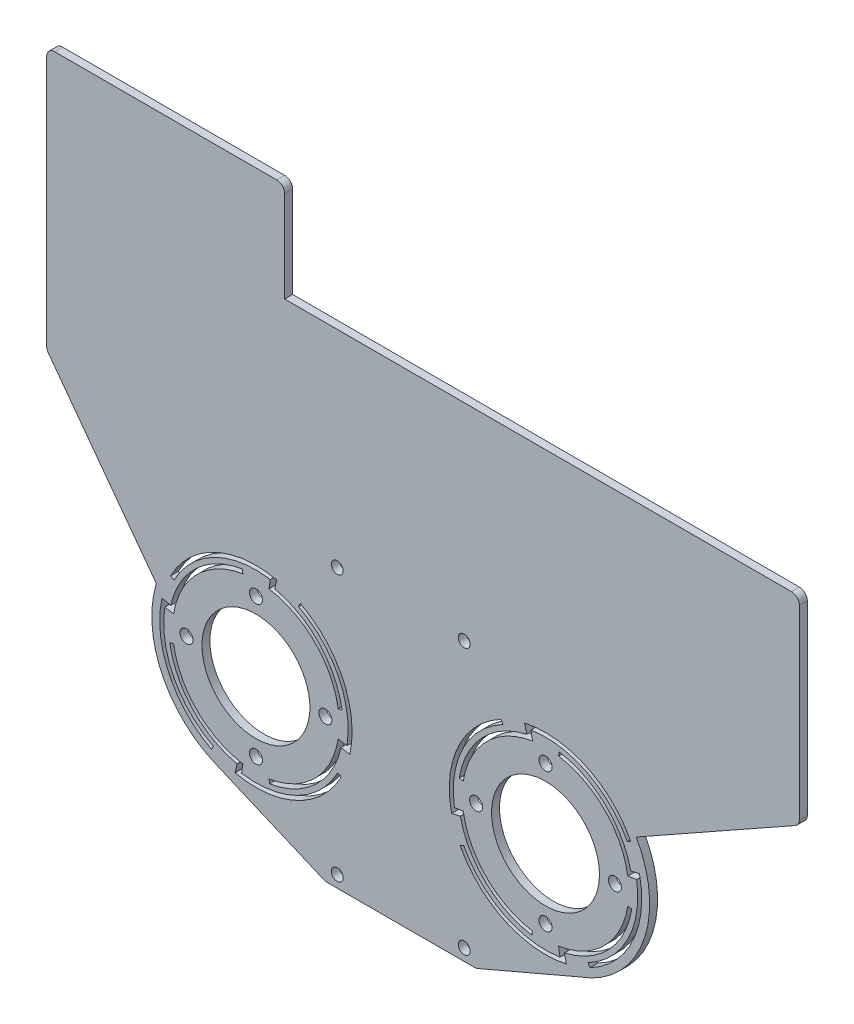
from build123d import *

# Parameters (mm, degrees)
SKETCH_1_R          = 21
SKETCH_1_R_2        = 13.6
SKETCH_1_R_3        = 1.65
EXTRUDE_1_DEPTH     = 2
EXTRUDE_1_2_DEPTH   = 2
SKETCH_2_R          = 26.25
EXTRUDE_3_DEPTH     = 2
EXTRUDE_4_DEPTH     = 2
FILLET_1_R          = 2
SKETCH_4_R          = 1.5
CUT_EXTRUDE_1_DEPTH = 2


with BuildPart() as part:
    # 草图1 → 凸台-拉伸1 (new body)
    with BuildSketch(Plane.XY):
        with Locations((36.5, 0)):
            Circle(SKETCH_1_R)
        with Locations((36.5, 0)):
            Circle(SKETCH_1_R_2, mode=Mode.SUBTRACT)
        with Locations((19, 0)):
            Circle(SKETCH_1_R_3, mode=Mode.SUBTRACT)
        with Locations((36.5, 17.5)):
            Circle(SKETCH_1_R_3, mode=Mode.SUBTRACT)
        with Locations((54, 0)):
            Circle(SKETCH_1_R_3, mode=Mode.SUBTRACT)
        with Locations((36.5, -17.5)):
            Circle(SKETCH_1_R_3, mode=Mode.SUBTRACT)
    extrude(amount=EXTRUDE_1_DEPTH)

    # 草图2 → 凸台-拉伸3 (add)
    # profile 1 of 4: a face of its own
    with BuildSketch(Plane.XY):
        with Locations((36.5, 0)):
            Circle(SKETCH_2_R)
        with BuildLine():
            Line((58.229143493, 3.441558231), (57.241455152, 3.285123766))
            ThreePointArc((57.241455152, 3.285123766), (57.435264008, 1.64764101), (57.5, 0))
            ThreePointArc((57.5, 0), (57.435264008, -1.64764101), (57.241455152, -3.285123766))
            Line((57.241455152, -3.285123766), (58.229143493, -3.441558231))
            ThreePointArc((58.229143493, -3.441558231), (52.524161337, -15.074025787), (41.261671507, -21.478512157))
            Line((41.261671507, -21.478512157), (41.748660638, -23.675178173))
            ThreePointArc((41.748660638, -23.675178173), (26.251507153, -21.977963836), (14.989987295, -11.197403871))
            Line((14.989987295, -11.197403871), (15.876998129, -10.735655258))
            ThreePointArc((15.876998129, -10.735655258), (26.035211246, -20.761760434), (40.137101312, -22.963753919))
            Line((40.137101312, -22.963753919), (39.785123766, -20.741455152))
            ThreePointArc((39.785123766, -20.741455152), (36.5, -21), (33.214876234, -20.741455152))
            Line((33.214876234, -20.741455152), (33.058441769, -21.729143493))
            ThreePointArc((33.058441769, -21.729143493), (21.425974213, -16.024161337), (15.021487843, -4.761671507))
            Line((15.021487843, -4.761671507), (12.824821827, -5.248660638))
            ThreePointArc((12.824821827, -5.248660638), (14.522036164, 10.248492847), (25.302596129, 21.510012705))
            Line((25.302596129, 21.510012705), (25.764344742, 20.623001871))
            ThreePointArc((25.764344742, 20.623001871), (15.738239566, 10.464788754), (13.536246081, -3.637101312))
            Line((13.536246081, -3.637101312), (14.770856507, -3.441558231))
            Line((14.770856507, -3.441558231), (15.758544848, -3.285123766))
            ThreePointArc((15.758544848, -3.285123766), (15.5, 0), (15.758544848, 3.285123766))
            Line((15.758544848, 3.285123766), (14.770856507, 3.441558231))
            ThreePointArc((14.770856507, 3.441558231), (20.475838663, 15.074025787), (31.738328493, 21.478512157))
            Line((31.738328493, 21.478512157), (31.251339362, 23.675178173))
            ThreePointArc((31.251339362, 23.675178173), (46.748492847, 21.977963836), (58.010012705, 11.197403871))
            ThreePointArc((58.010012705, 11.197403871), (59.287546054, 8.293988476), (60.175178173, 5.248660638))
            ThreePointArc((60.175178173, 5.248660638), (58.477963836, -10.248492847), (47.697403871, -21.510012705))
            Line((47.697403871, -21.510012705), (47.235655258, -20.623001871))
            ThreePointArc((47.235655258, -20.623001871), (57.261760434, -10.464788754), (59.463753919, 3.637101312))
            Line((59.463753919, 3.637101312), (58.229143493, 3.441558231))
        make_face(mode=Mode.SUBTRACT)
    # profile 2 of 4: a face of its own
    with BuildSketch(Plane.XY):
        with BuildLine():
            Line((39.785123766, 20.741455152), (39.941558231, 21.729143493))
            ThreePointArc((39.941558231, 21.729143493), (51.574025787, 16.024161337), (57.978512157, 4.761671507))
            Line((57.978512157, 4.761671507), (60.175178173, 5.248660638))
            ThreePointArc((60.175178173, 5.248660638), (59.287546054, 8.293988476), (58.010012705, 11.197403871))
            Line((58.010012705, 11.197403871), (57.123001871, 10.735655258))
            ThreePointArc((57.123001871, 10.735655258), (46.964788754, 20.761760434), (32.862898688, 22.963753919))
            Line((32.862898688, 22.963753919), (33.214876234, 20.741455152))
            ThreePointArc((33.214876234, 20.741455152), (36.5, 21), (39.785123766, 20.741455152))
        make_face()
    # profile 3 of 4: a face of its own
    with BuildSketch(Plane.XY):
        with Locations((-36.5, 0)):
            Circle(SKETCH_2_R)
        with BuildLine():
            ThreePointArc((-31.738328493, 21.478512157), (-20.475838663, 15.074025787), (-14.770856507, 3.441558231))
            Line((-14.770856507, 3.441558231), (-15.758544848, 3.285123766))
            ThreePointArc((-15.758544848, 3.285123766), (-15.564735992, 1.64764101), (-15.5, 0))
            ThreePointArc((-15.5, 0), (-15.564735992, -1.64764101), (-15.758544848, -3.285123766))
            Line((-15.758544848, -3.285123766), (-14.770856507, -3.441558231))
            Line((-14.770856507, -3.441558231), (-13.536246081, -3.637101312))
            ThreePointArc((-13.536246081, -3.637101312), (-15.738239566, 10.464788754), (-25.764344742, 20.623001871))
            Line((-25.764344742, 20.623001871), (-25.302596129, 21.510012705))
            ThreePointArc((-25.302596129, 21.510012705), (-14.522036164, 10.248492847), (-12.824821827, -5.248660638))
            Line((-12.824821827, -5.248660638), (-15.021487843, -4.761671507))
            ThreePointArc((-15.021487843, -4.761671507), (-21.425974213, -16.024161337), (-33.058441769, -21.729143493))
            Line((-33.058441769, -21.729143493), (-33.214876234, -20.741455152))
            ThreePointArc((-33.214876234, -20.741455152), (-36.5, -21), (-39.785123766, -20.741455152))
            Line((-39.785123766, -20.741455152), (-40.137101312, -22.963753919))
            ThreePointArc((-40.137101312, -22.963753919), (-26.035211246, -20.761760434), (-15.876998129, -10.735655258))
            Line((-15.876998129, -10.735655258), (-14.989987295, -11.197403871))
            ThreePointArc((-14.989987295, -11.197403871), (-26.251507153, -21.977963836), (-41.748660638, -23.675178173))
            Line((-41.748660638, -23.675178173), (-41.261671507, -21.478512157))
            ThreePointArc((-41.261671507, -21.478512157), (-52.524161337, -15.074025787), (-58.229143493, -3.441558231))
            Line((-58.229143493, -3.441558231), (-57.241455152, -3.285123766))
            ThreePointArc((-57.241455152, -3.285123766), (-57.5, 0), (-57.241455152, 3.285123766))
            Line((-57.241455152, 3.285123766), (-58.229143493, 3.441558231))
            Line((-58.229143493, 3.441558231), (-59.463753919, 3.637101312))
            ThreePointArc((-59.463753919, 3.637101312), (-57.261760434, -10.464788754), (-47.235655258, -20.623001871))
            Line((-47.235655258, -20.623001871), (-47.697403871, -21.510012705))
            ThreePointArc((-47.697403871, -21.510012705), (-58.477963836, -10.248492847), (-60.175178173, 5.248660638))
            ThreePointArc((-60.175178173, 5.248660638), (-59.287546054, 8.293988476), (-58.010012705, 11.197403871))
            ThreePointArc((-58.010012705, 11.197403871), (-46.748492847, 21.977963836), (-31.251339362, 23.675178173))
            Line((-31.251339362, 23.675178173), (-31.738328493, 21.478512157))
        make_face(mode=Mode.SUBTRACT)
    # profile 4 of 4: a face of its own
    with BuildSketch(Plane.XY):
        with BuildLine():
            ThreePointArc((-39.785123766, 20.741455152), (-36.5, 21), (-33.214876234, 20.741455152))
            Line((-33.214876234, 20.741455152), (-32.862898688, 22.963753919))
            ThreePointArc((-32.862898688, 22.963753919), (-46.964788754, 20.761760434), (-57.123001871, 10.735655258))
            Line((-57.123001871, 10.735655258), (-58.010012705, 11.197403871))
            ThreePointArc((-58.010012705, 11.197403871), (-59.287546054, 8.293988476), (-60.175178173, 5.248660638))
            Line((-60.175178173, 5.248660638), (-57.978512157, 4.761671507))
            ThreePointArc((-57.978512157, 4.761671507), (-51.574025787, 16.024161337), (-39.941558231, 21.729143493))
            Line((-39.941558231, 21.729143493), (-39.785123766, 20.741455152))
        make_face()
    extrude(amount=EXTRUDE_3_DEPTH)


with BuildPart() as body_2:
    # 草图1 → Extrude 1 2 (new body)
    with BuildSketch(Plane.XY):
        with Locations(Location((-36.5, 0, 0), (0, 0, 180))):
            Circle(SKETCH_1_R)
        with Locations(Location((-36.5, -17.5, 0), (0, 0, 180))):
            Circle(SKETCH_1_R_3, mode=Mode.SUBTRACT)
        with Locations(Location((-54, 0, 0), (0, 0, 180))):
            Circle(SKETCH_1_R_3, mode=Mode.SUBTRACT)
        with Locations(Location((-36.5, 17.5, 0), (0, 0, 180))):
            Circle(SKETCH_1_R_3, mode=Mode.SUBTRACT)
        with Locations(Location((-19, 0, 0), (0, 0, 180))):
            Circle(SKETCH_1_R_3, mode=Mode.SUBTRACT)
        with Locations(Location((-36.5, 0, 0), (0, 0, 180))):
            Circle(SKETCH_1_R_2, mode=Mode.SUBTRACT)
    extrude(amount=EXTRUDE_1_2_DEPTH)


with BuildPart() as extrude_3_piece_1:
    # of the separate pieces the step leaves, piece 1, a body of its own (extrude_3_pieces)
    add(part.part.solids().sort_by_distance((57.241455152, 3.285123766, 0))[0])



with BuildPart() as extrude_3_piece_2:
    # of the separate pieces the step leaves, piece 2, a body of its own (extrude_3_pieces)
    add(part.part.solids().sort_by_distance((-10.25, 0, 0))[0])


with BuildPart() as extrude_3_piece_1_1:
    add(extrude_3_piece_1.part)

    add(extrude_3_piece_2.part)  # 凸台-拉伸4 merges 凸台-拉伸3 piece 2

    add(body_2.part)  # 凸台-拉伸4 merges body 2
    # 草图3 → 凸台-拉伸4 (add)
    with BuildSketch(Plane.XY):
        with BuildLine():
            Line((0, -36), (0, 0))
            Line((0, 0), (0, 86))
            Line((0, 86), (-29.25, 86))
            Line((-29.25, 86), (-29.25, 111))
            Line((-29.25, 111), (-89.25, 111))
            Line((-89.25, 111), (-89.25, 45))
            Line((-89.25, 45), (-61.597026322, 7.694268631))
            ThreePointArc((-61.597026322, 7.694268631), (-32.609912659, 25.960156403), (-10.25, 0))
            ThreePointArc((-10.25, 0), (-22.029919095, -21.90158119), (-46.796991132, -24.1461068))
            Line((-46.796991132, -24.1461068), (-19, -36))
            Line((-19, -36), (0, -36))
        make_face()
        with BuildLine():
            Line((0, 86), (0, 0))
            Line((0, 0), (0, -36))
            Line((0, -36), (19, -36))
            Line((19, -36), (45.243812785, -24.750923982))
            ThreePointArc((45.243812785, -24.750923982), (11.927256564, 9.232701664), (59.37885785, 12.86935754))
            Line((59.37885785, 12.86935754), (100.5, 36))
            Line((100.5, 36), (100.5, 86))
            Line((100.5, 86), (29.25, 86))
            Line((29.25, 86), (0, 86))
        make_face()
    extrude(amount=EXTRUDE_4_DEPTH)

    # 圆角1
    fillet_1_edges = [extrude_3_piece_1_1.edges().sort_by_distance(p)[0] for p in [
        (-19, -36, 1),
        (19, -36, 1),
        (100.5, 36, 1),
        (100.5, 86, 1),
        (-29.25, 111, 1),
        (-89.25, 111, 1),
        (-89.25, 45, 1),
    ]]
    fillet(fillet_1_edges, radius=FILLET_1_R)

    # 草图4 → 切除-拉伸1 (cut)
    with BuildSketch(Plane.XY.offset(2)):
        with Locations((-16, -33)):
            Circle(SKETCH_4_R)
        with Locations((16, -33)):
            Circle(SKETCH_4_R)
        with Locations((-16, 34)):
            Circle(SKETCH_4_R)
        with Locations((16, 34)):
            Circle(SKETCH_4_R)
    extrude(amount=-CUT_EXTRUDE_1_DEPTH, mode=Mode.SUBTRACT)


solid = extrude_3_piece_1_1.part
